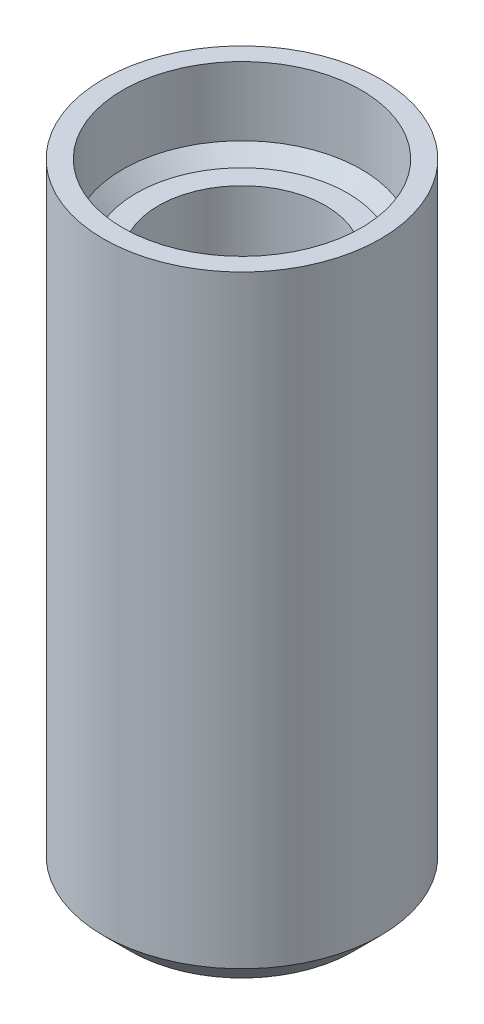
from build123d import *

# Parameters (mm, degrees)
SKETCH1_R           = 5.05
BOSS_EXTRUDE1_DEPTH = 20
SKETCH2_R           = 5.05
BOSS_EXTRUDE2_DEPTH = 2
SKETCH4_R           = 5.05
SKETCH4_R_2         = 4.35
BOSS_EXTRUDE3_DEPTH = 3
CHAMFER1_SIZE       = 1
CHAMFER2_SIZE       = 0.5
CUT_EXTRUDE1_DEPTH  = 0.4
BOSS_EXTRUDE4_DEPTH = 0.4


with BuildPart() as part:
    # Sketch1 → Boss-Extrude1 (new body)
    with BuildSketch(Plane(origin=(0, 0, 0), x_dir=(1, 0, 0), z_dir=(0, 1, 0))):
        Circle(SKETCH1_R)
        with BuildLine():
            Line((2.565151068, -1.65), (-2.565151068, -1.65))
            ThreePointArc((-2.565151068, -1.65), (0, 3.05), (2.565151068, -1.65))
        make_face(mode=Mode.SUBTRACT)
    extrude(amount=BOSS_EXTRUDE1_DEPTH)

    # Sketch2 → Boss-Extrude2 (add)
    with BuildSketch(Plane.XZ):
        Circle(SKETCH2_R)
    extrude(amount=-BOSS_EXTRUDE2_DEPTH)

    # Sketch4 → Boss-Extrude3 (add)
    with BuildSketch(Plane(origin=(0, 20, 0), x_dir=(1, 0, 0), z_dir=(0, 1, 0))):
        Circle(SKETCH4_R)
        Circle(SKETCH4_R_2, mode=Mode.SUBTRACT)
    extrude(amount=BOSS_EXTRUDE3_DEPTH)

    # Chamfer1
    chamfer1_edges = [part.edges().sort_by_distance(p)[0] for p in [
        (-5.05, 0, 0),
    ]]
    chamfer(chamfer1_edges, length=CHAMFER1_SIZE)

    # Chamfer2
    chamfer2_edges = [part.edges().sort_by_distance(p)[0] for p in [
        (-4.35, 20, 0),
    ]]
    chamfer(chamfer2_edges, length=CHAMFER2_SIZE)

    # Sketch5 → Cut-Extrude1 (cut)
    with BuildSketch(Plane.XZ):
        with BuildLine():
            add(Edge.make_bspline(
                [(1.439948587, 0.372915275), (1.438414833, 0.283221846), (1.435292452, 0.100625971), (1.415515547, -0.175260744), (1.379464827, -0.453671336), (1.326996472, -0.68213894), (1.271957516, -0.860480117), (1.224687789, -0.991487322), (1.167641882, -1.118290273), (1.106888791, -1.242702679), (1.03591101, -1.360635518), (0.955443549, -1.471529104), (0.865233931, -1.574407128), (0.765999015, -1.670409783), (0.655239661, -1.756606556), (0.533594714, -1.833716716), (0.400942513, -1.902157244), (0.256325636, -1.959957444), (0.099724915, -2.00772), (-0.070595294, -2.03982333), (-0.253832354, -2.060112999), (-0.380595978, -2.062675769), (-0.445984076, -2.063997715)],
                knots=[0, 0, 0, 0, 1.530452467, 3.115660856, 4.717120825, 6.316155104, 7.107717915, 7.901219459, 8.690633922, 9.479125872, 10.262369726, 11.035951869, 11.813891433, 12.594259698, 13.388392856, 14.204106484, 15.048617214, 15.931552947, 16.858194854, 17.837533564, 18.88454144, 20, 20, 20, 20], degree=3))
            add(Edge.make_bspline(
                [(-0.445984076, -2.063997715), (-0.493693304, -2.063111388), (-0.589380147, -2.061333748), (-0.729996081, -2.04479171), (-0.863509879, -2.020461508), (-0.985736482, -1.993820906), (-1.092384864, -1.961078385), (-1.182968817, -1.930046925), (-1.25341845, -1.895657117), (-1.307314706, -1.858696834), (-1.34195128, -1.808289431), (-1.364043928, -1.743033062), (-1.374190299, -1.656319496), (-1.375313893, -1.591029545), (-1.375950872, -1.554015924)],
                knots=[0, 0, 0, 0, 1.415567452, 2.839098147, 4.19559782, 5.443570995, 6.548449895, 7.506082698, 8.280334572, 8.873916226, 9.420186956, 10.061709937, 10.901161162, 12, 12, 12, 12], degree=3))
            add(Edge.make_bspline(
                [(-1.375950872, -1.554015924), (-1.375932579, -1.519677287), (-1.375900237, -1.458968753), (-1.371907056, -1.377873113), (-1.366042693, -1.31575732), (-1.35487271, -1.268949571), (-1.338090694, -1.236667642), (-1.317211441, -1.215366685), (-1.29122845, -1.206669484), (-1.273326528, -1.205592294), (-1.263954871, -1.205028384)],
                knots=[0, 0, 0, 0, 2.032661161, 3.59361613, 4.805268322, 5.724313949, 6.422003636, 6.938482535, 7.444295529, 8, 8, 8, 8], degree=3))
            add(Edge.make_bspline(
                [(-1.263954871, -1.205028384), (-1.248190888, -1.206538324), (-1.210307731, -1.21016693), (-1.147179339, -1.231306287), (-1.067264126, -1.255122113), (-0.972462937, -1.285703118), (-0.862077579, -1.312270546), (-0.7380053, -1.339961939), (-0.598420831, -1.35676124), (-0.50036097, -1.358901496), (-0.448983969, -1.36002285)],
                knots=[0, 0, 0, 0, 0.454886135, 1.093157942, 1.906996258, 2.860593712, 3.959632549, 5.175984069, 6.52039899, 8, 8, 8, 8], degree=3))
            add(Edge.make_bspline(
                [(-0.448983969, -1.36002285), (-0.404587009, -1.358964975), (-0.319065971, -1.356927209), (-0.19625274, -1.338787467), (-0.08400163, -1.308968793), (0.017943428, -1.266909773), (0.109087824, -1.21304184), (0.191787163, -1.152277284), (0.264748532, -1.08209849), (0.32878484, -1.003641442), (0.38479841, -0.917795362), (0.431430919, -0.824782552), (0.472428683, -0.72661522), (0.502172769, -0.621179974), (0.527226142, -0.511373455), (0.54653687, -0.396904593), (0.55798365, -0.278253936), (0.561966865, -0.197750069), (0.563979863, -0.157065802)],
                knots=[0, 0, 0, 0, 1.196452134, 2.304703457, 3.338022325, 4.321033733, 5.26741902, 6.185870945, 7.082070246, 7.988796301, 8.911065345, 9.839487427, 10.790724476, 11.774598157, 12.788348706, 13.826968678, 14.901814414, 16, 16, 16, 16], degree=3))
            add(Edge.make_bspline(
                [(0.563979863, -0.157065802), (0.537154343, -0.173039076), (0.481761298, -0.206022902), (0.393048378, -0.250761626), (0.296048259, -0.291732422), (0.192049452, -0.33004991), (0.079097954, -0.361128399), (-0.041532039, -0.384226108), (-0.170727048, -0.396860469), (-0.259298245, -0.398969268), (-0.30498911, -0.400057126)],
                knots=[0, 0, 0, 0, 0.819177999, 1.691551994, 2.604680621, 3.581455082, 4.597998137, 5.675384002, 6.800809734, 8, 8, 8, 8], degree=3))
            add(Edge.make_bspline(
                [(-0.30498911, -0.400057126), (-0.360367334, -0.398935942), (-0.466736188, -0.396782405), (-0.619952591, -0.379586941), (-0.76023709, -0.351980724), (-0.888568429, -0.313818977), (-1.003266311, -0.261271162), (-1.108567773, -0.202311809), (-1.20071382, -0.130131032), (-1.283374766, -0.04977143), (-1.352622217, 0.042185935), (-1.413953075, 0.141753294), (-1.462167823, 0.25190833), (-1.502402977, 0.369907109), (-1.532162547, 0.496921027), (-1.552422785, 0.631719568), (-1.566109258, 0.774287386), (-1.567322125, 0.871863846), (-1.567944017, 0.921895674)],
                knots=[0, 0, 0, 0, 1.26368579, 2.427250315, 3.513406343, 4.524100759, 5.474197979, 6.387616679, 7.271703274, 8.137800737, 9.011217839, 9.891893745, 10.801057316, 11.748928517, 12.734281238, 13.773658334, 14.85845475, 16, 16, 16, 16], degree=3))
            add(Edge.make_bspline(
                [(-1.567944017, 0.921895674), (-1.566803551, 0.975271844), (-1.564565766, 1.08000489), (-1.546621627, 1.233732247), (-1.51490916, 1.380304409), (-1.473830592, 1.520754457), (-1.418585724, 1.653067192), (-1.351207403, 1.776474992), (-1.273229809, 1.891346303), (-1.182553433, 1.995967223), (-1.079813959, 2.090398004), (-0.965743875, 2.174660339), (-0.839392616, 2.246968185), (-0.701740044, 2.307954261), (-0.552325672, 2.35768346), (-0.390764969, 2.390247743), (-0.218598307, 2.412292816), (-0.100071191, 2.414635326), (-0.038998608, 2.415842333)],
                knots=[0, 0, 0, 0, 1.058739241, 2.077424914, 3.064368277, 4.030875631, 4.976459198, 5.902630337, 6.81601363, 7.72546301, 8.642668007, 9.579027735, 10.532898379, 11.524548813, 12.561716757, 13.649805084, 14.789032581, 16, 16, 16, 16], degree=3))
            add(Edge.make_bspline(
                [(-0.038998608, 2.415842333), (0.010031609, 2.415210495), (0.104944931, 2.413987374), (0.242637891, 2.400722697), (0.370816385, 2.379280379), (0.489800249, 2.347963195), (0.600015158, 2.308792684), (0.702577064, 2.2632927), (0.796572123, 2.208654464), (0.882252061, 2.146210585), (0.962485109, 2.07853523), (1.032901136, 2.001375884), (1.099110312, 1.919408477), (1.156076828, 1.829024615), (1.208660752, 1.733728983), (1.254340098, 1.632603022), (1.294476455, 1.526403892), (1.340000091, 1.375980495), (1.384779734, 1.175476474), (1.416449938, 0.920617992), (1.437198282, 0.651255433), (1.439019384, 0.466953792), (1.439948587, 0.372915275)],
                knots=[0, 0, 0, 0, 1.014424697, 1.96373635, 2.859665263, 3.701285511, 4.506378885, 5.278248456, 6.020095848, 6.751445251, 7.470491163, 8.187946996, 8.909767116, 9.648368037, 10.395456877, 11.161043306, 11.942593023, 12.743419402, 14.411965646, 16.186598095, 18.054240574, 20, 20, 20, 20], degree=3))
        make_face()
        with BuildLine():
            add(Edge.make_bspline(
                [(0.543980577, 0.509910384), (0.543829582, 0.564922501), (0.543539307, 0.670678862), (0.534927664, 0.822059673), (0.523628549, 0.959588702), (0.506787153, 1.08313268), (0.484944963, 1.194075055), (0.458178159, 1.292630014), (0.427687942, 1.38019473), (0.390401394, 1.45531319), (0.349153759, 1.520925456), (0.302405349, 1.575917269), (0.25061944, 1.621020917), (0.193683115, 1.655657523), (0.131418093, 1.680005901), (0.065753017, 1.699887295), (-0.005745379, 1.709147251), (-0.054647611, 1.710938787), (-0.079997144, 1.711867468)],
                knots=[0, 0, 0, 0, 1.724037892, 3.314323882, 4.751173022, 6.048486653, 7.220520937, 8.292645254, 9.247761345, 10.121524596, 10.915637301, 11.671508539, 12.375253584, 13.05973367, 13.748506206, 14.466075588, 15.204857005, 16, 16, 16, 16], degree=3))
            add(Edge.make_bspline(
                [(-0.079997144, 1.711867468), (-0.104701055, 1.711423646), (-0.15233118, 1.71056794), (-0.221427258, 1.700237091), (-0.285168976, 1.683464174), (-0.362312088, 1.653121988), (-0.448043354, 1.59887474), (-0.53152727, 1.510179423), (-0.595842, 1.402461872), (-0.640039758, 1.277652934), (-0.667388297, 1.138404435), (-0.67040675, 1.040692507), (-0.671976007, 0.989893246)],
                knots=[0, 0, 0, 0, 0.700350648, 1.350303964, 1.976502457, 2.566526108, 3.697232059, 4.820917017, 5.991835401, 7.230375072, 8.56010518, 10, 10, 10, 10], degree=3))
            add(Edge.make_bspline(
                [(-0.671976007, 0.989893246), (-0.670479057, 0.936489709), (-0.66764715, 0.83546179), (-0.645882502, 0.693678355), (-0.606373027, 0.572457211), (-0.549549814, 0.471044422), (-0.468754326, 0.394317546), (-0.386685918, 0.349535363), (-0.312059601, 0.326705109), (-0.249467871, 0.313680005), (-0.181527645, 0.305735813), (-0.13435023, 0.304536734), (-0.109996073, 0.303917739)],
                knots=[0, 0, 0, 0, 1.565833155, 2.962216993, 4.189303543, 5.288982354, 6.332815194, 7.413212199, 7.997463676, 8.616645061, 9.285877698, 10, 10, 10, 10], degree=3))
            add(Edge.make_bspline(
                [(-0.109996073, 0.303917739), (-0.078980586, 0.304875035), (-0.017462122, 0.306773809), (0.073367873, 0.316159175), (0.161060139, 0.335012275), (0.273212157, 0.366325696), (0.404657263, 0.419832826), (0.49845003, 0.48047324), (0.543980577, 0.509910384)],
                knots=[0, 0, 0, 0, 0.802046375, 1.590839501, 2.356323732, 3.117333683, 4.600645023, 6, 6, 6, 6], degree=3))
        make_face(mode=Mode.SUBTRACT)
    extrude(amount=-CUT_EXTRUDE1_DEPTH, mode=Mode.SUBTRACT)


with BuildPart() as body_2:
    # Sketch5<2> → Boss-Extrude4 (new body)
    with BuildSketch(Plane.XZ):
        with BuildLine():
            add(Edge.make_bspline(
                [(1.439948587, 0.372915275), (1.438414833, 0.283221846), (1.435292452, 0.100625971), (1.415515547, -0.175260744), (1.379464827, -0.453671336), (1.326996472, -0.68213894), (1.271957516, -0.860480117), (1.224687789, -0.991487322), (1.167641882, -1.118290273), (1.106888791, -1.242702679), (1.03591101, -1.360635518), (0.955443549, -1.471529104), (0.865233931, -1.574407128), (0.765999015, -1.670409783), (0.655239661, -1.756606556), (0.533594714, -1.833716716), (0.400942513, -1.902157244), (0.256325636, -1.959957444), (0.099724915, -2.00772), (-0.070595294, -2.03982333), (-0.253832354, -2.060112999), (-0.380595978, -2.062675769), (-0.445984076, -2.063997715)],
                knots=[0, 0, 0, 0, 1.530452467, 3.115660856, 4.717120825, 6.316155104, 7.107717915, 7.901219459, 8.690633922, 9.479125872, 10.262369726, 11.035951869, 11.813891433, 12.594259698, 13.388392856, 14.204106484, 15.048617214, 15.931552947, 16.858194854, 17.837533564, 18.88454144, 20, 20, 20, 20], degree=3))
            add(Edge.make_bspline(
                [(-0.445984076, -2.063997715), (-0.493693304, -2.063111388), (-0.589380147, -2.061333748), (-0.729996081, -2.04479171), (-0.863509879, -2.020461508), (-0.985736482, -1.993820906), (-1.092384864, -1.961078385), (-1.182968817, -1.930046925), (-1.25341845, -1.895657117), (-1.307314706, -1.858696834), (-1.34195128, -1.808289431), (-1.364043928, -1.743033062), (-1.374190299, -1.656319496), (-1.375313893, -1.591029545), (-1.375950872, -1.554015924)],
                knots=[0, 0, 0, 0, 1.415567452, 2.839098147, 4.19559782, 5.443570995, 6.548449895, 7.506082698, 8.280334572, 8.873916226, 9.420186956, 10.061709937, 10.901161162, 12, 12, 12, 12], degree=3))
            add(Edge.make_bspline(
                [(-1.375950872, -1.554015924), (-1.375932579, -1.519677287), (-1.375900237, -1.458968753), (-1.371907056, -1.377873113), (-1.366042693, -1.31575732), (-1.35487271, -1.268949571), (-1.338090694, -1.236667642), (-1.317211441, -1.215366685), (-1.29122845, -1.206669484), (-1.273326528, -1.205592294), (-1.263954871, -1.205028384)],
                knots=[0, 0, 0, 0, 2.032661161, 3.59361613, 4.805268322, 5.724313949, 6.422003636, 6.938482535, 7.444295529, 8, 8, 8, 8], degree=3))
            add(Edge.make_bspline(
                [(-1.263954871, -1.205028384), (-1.248190888, -1.206538324), (-1.210307731, -1.21016693), (-1.147179339, -1.231306287), (-1.067264126, -1.255122113), (-0.972462937, -1.285703118), (-0.862077579, -1.312270546), (-0.7380053, -1.339961939), (-0.598420831, -1.35676124), (-0.50036097, -1.358901496), (-0.448983969, -1.36002285)],
                knots=[0, 0, 0, 0, 0.454886135, 1.093157942, 1.906996258, 2.860593712, 3.959632549, 5.175984069, 6.52039899, 8, 8, 8, 8], degree=3))
            add(Edge.make_bspline(
                [(-0.448983969, -1.36002285), (-0.404587009, -1.358964975), (-0.319065971, -1.356927209), (-0.19625274, -1.338787467), (-0.08400163, -1.308968793), (0.017943428, -1.266909773), (0.109087824, -1.21304184), (0.191787163, -1.152277284), (0.264748532, -1.08209849), (0.32878484, -1.003641442), (0.38479841, -0.917795362), (0.431430919, -0.824782552), (0.472428683, -0.72661522), (0.502172769, -0.621179974), (0.527226142, -0.511373455), (0.54653687, -0.396904593), (0.55798365, -0.278253936), (0.561966865, -0.197750069), (0.563979863, -0.157065802)],
                knots=[0, 0, 0, 0, 1.196452134, 2.304703457, 3.338022325, 4.321033733, 5.26741902, 6.185870945, 7.082070246, 7.988796301, 8.911065345, 9.839487427, 10.790724476, 11.774598157, 12.788348706, 13.826968678, 14.901814414, 16, 16, 16, 16], degree=3))
            add(Edge.make_bspline(
                [(0.563979863, -0.157065802), (0.537154343, -0.173039076), (0.481761298, -0.206022902), (0.393048378, -0.250761626), (0.296048259, -0.291732422), (0.192049452, -0.33004991), (0.079097954, -0.361128399), (-0.041532039, -0.384226108), (-0.170727048, -0.396860469), (-0.259298245, -0.398969268), (-0.30498911, -0.400057126)],
                knots=[0, 0, 0, 0, 0.819177999, 1.691551994, 2.604680621, 3.581455082, 4.597998137, 5.675384002, 6.800809734, 8, 8, 8, 8], degree=3))
            add(Edge.make_bspline(
                [(-0.30498911, -0.400057126), (-0.360367334, -0.398935942), (-0.466736188, -0.396782405), (-0.619952591, -0.379586941), (-0.76023709, -0.351980724), (-0.888568429, -0.313818977), (-1.003266311, -0.261271162), (-1.108567773, -0.202311809), (-1.20071382, -0.130131032), (-1.283374766, -0.04977143), (-1.352622217, 0.042185935), (-1.413953075, 0.141753294), (-1.462167823, 0.25190833), (-1.502402977, 0.369907109), (-1.532162547, 0.496921027), (-1.552422785, 0.631719568), (-1.566109258, 0.774287386), (-1.567322125, 0.871863846), (-1.567944017, 0.921895674)],
                knots=[0, 0, 0, 0, 1.26368579, 2.427250315, 3.513406343, 4.524100759, 5.474197979, 6.387616679, 7.271703274, 8.137800737, 9.011217839, 9.891893745, 10.801057316, 11.748928517, 12.734281238, 13.773658334, 14.85845475, 16, 16, 16, 16], degree=3))
            add(Edge.make_bspline(
                [(-1.567944017, 0.921895674), (-1.566803551, 0.975271844), (-1.564565766, 1.08000489), (-1.546621627, 1.233732247), (-1.51490916, 1.380304409), (-1.473830592, 1.520754457), (-1.418585724, 1.653067192), (-1.351207403, 1.776474992), (-1.273229809, 1.891346303), (-1.182553433, 1.995967223), (-1.079813959, 2.090398004), (-0.965743875, 2.174660339), (-0.839392616, 2.246968185), (-0.701740044, 2.307954261), (-0.552325672, 2.35768346), (-0.390764969, 2.390247743), (-0.218598307, 2.412292816), (-0.100071191, 2.414635326), (-0.038998608, 2.415842333)],
                knots=[0, 0, 0, 0, 1.058739241, 2.077424914, 3.064368277, 4.030875631, 4.976459198, 5.902630337, 6.81601363, 7.72546301, 8.642668007, 9.579027735, 10.532898379, 11.524548813, 12.561716757, 13.649805084, 14.789032581, 16, 16, 16, 16], degree=3))
            add(Edge.make_bspline(
                [(-0.038998608, 2.415842333), (0.010031609, 2.415210495), (0.104944931, 2.413987374), (0.242637891, 2.400722697), (0.370816385, 2.379280379), (0.489800249, 2.347963195), (0.600015158, 2.308792684), (0.702577064, 2.2632927), (0.796572123, 2.208654464), (0.882252061, 2.146210585), (0.962485109, 2.07853523), (1.032901136, 2.001375884), (1.099110312, 1.919408477), (1.156076828, 1.829024615), (1.208660752, 1.733728983), (1.254340098, 1.632603022), (1.294476455, 1.526403892), (1.340000091, 1.375980495), (1.384779734, 1.175476474), (1.416449938, 0.920617992), (1.437198282, 0.651255433), (1.439019384, 0.466953792), (1.439948587, 0.372915275)],
                knots=[0, 0, 0, 0, 1.014424697, 1.96373635, 2.859665263, 3.701285511, 4.506378885, 5.278248456, 6.020095848, 6.751445251, 7.470491163, 8.187946996, 8.909767116, 9.648368037, 10.395456877, 11.161043306, 11.942593023, 12.743419402, 14.411965646, 16.186598095, 18.054240574, 20, 20, 20, 20], degree=3))
        make_face()
        with BuildLine():
            add(Edge.make_bspline(
                [(0.543980577, 0.509910384), (0.543829582, 0.564922501), (0.543539307, 0.670678862), (0.534927664, 0.822059673), (0.523628549, 0.959588702), (0.506787153, 1.08313268), (0.484944963, 1.194075055), (0.458178159, 1.292630014), (0.427687942, 1.38019473), (0.390401394, 1.45531319), (0.349153759, 1.520925456), (0.302405349, 1.575917269), (0.25061944, 1.621020917), (0.193683115, 1.655657523), (0.131418093, 1.680005901), (0.065753017, 1.699887295), (-0.005745379, 1.709147251), (-0.054647611, 1.710938787), (-0.079997144, 1.711867468)],
                knots=[0, 0, 0, 0, 1.724037892, 3.314323882, 4.751173022, 6.048486653, 7.220520937, 8.292645254, 9.247761345, 10.121524596, 10.915637301, 11.671508539, 12.375253584, 13.05973367, 13.748506206, 14.466075588, 15.204857005, 16, 16, 16, 16], degree=3))
            add(Edge.make_bspline(
                [(-0.079997144, 1.711867468), (-0.104701055, 1.711423646), (-0.15233118, 1.71056794), (-0.221427258, 1.700237091), (-0.285168976, 1.683464174), (-0.362312088, 1.653121988), (-0.448043354, 1.59887474), (-0.53152727, 1.510179423), (-0.595842, 1.402461872), (-0.640039758, 1.277652934), (-0.667388297, 1.138404435), (-0.67040675, 1.040692507), (-0.671976007, 0.989893246)],
                knots=[0, 0, 0, 0, 0.700350648, 1.350303964, 1.976502457, 2.566526108, 3.697232059, 4.820917017, 5.991835401, 7.230375072, 8.56010518, 10, 10, 10, 10], degree=3))
            add(Edge.make_bspline(
                [(-0.671976007, 0.989893246), (-0.670479057, 0.936489709), (-0.66764715, 0.83546179), (-0.645882502, 0.693678355), (-0.606373027, 0.572457211), (-0.549549814, 0.471044422), (-0.468754326, 0.394317546), (-0.386685918, 0.349535363), (-0.312059601, 0.326705109), (-0.249467871, 0.313680005), (-0.181527645, 0.305735813), (-0.13435023, 0.304536734), (-0.109996073, 0.303917739)],
                knots=[0, 0, 0, 0, 1.565833155, 2.962216993, 4.189303543, 5.288982354, 6.332815194, 7.413212199, 7.997463676, 8.616645061, 9.285877698, 10, 10, 10, 10], degree=3))
            add(Edge.make_bspline(
                [(-0.109996073, 0.303917739), (-0.078980586, 0.304875035), (-0.017462122, 0.306773809), (0.073367873, 0.316159175), (0.161060139, 0.335012275), (0.273212157, 0.366325696), (0.404657263, 0.419832826), (0.49845003, 0.48047324), (0.543980577, 0.509910384)],
                knots=[0, 0, 0, 0, 0.802046375, 1.590839501, 2.356323732, 3.117333683, 4.600645023, 6, 6, 6, 6], degree=3))
        make_face(mode=Mode.SUBTRACT)
    extrude(amount=-BOSS_EXTRUDE4_DEPTH)


solid = Compound([part.part, body_2.part])
